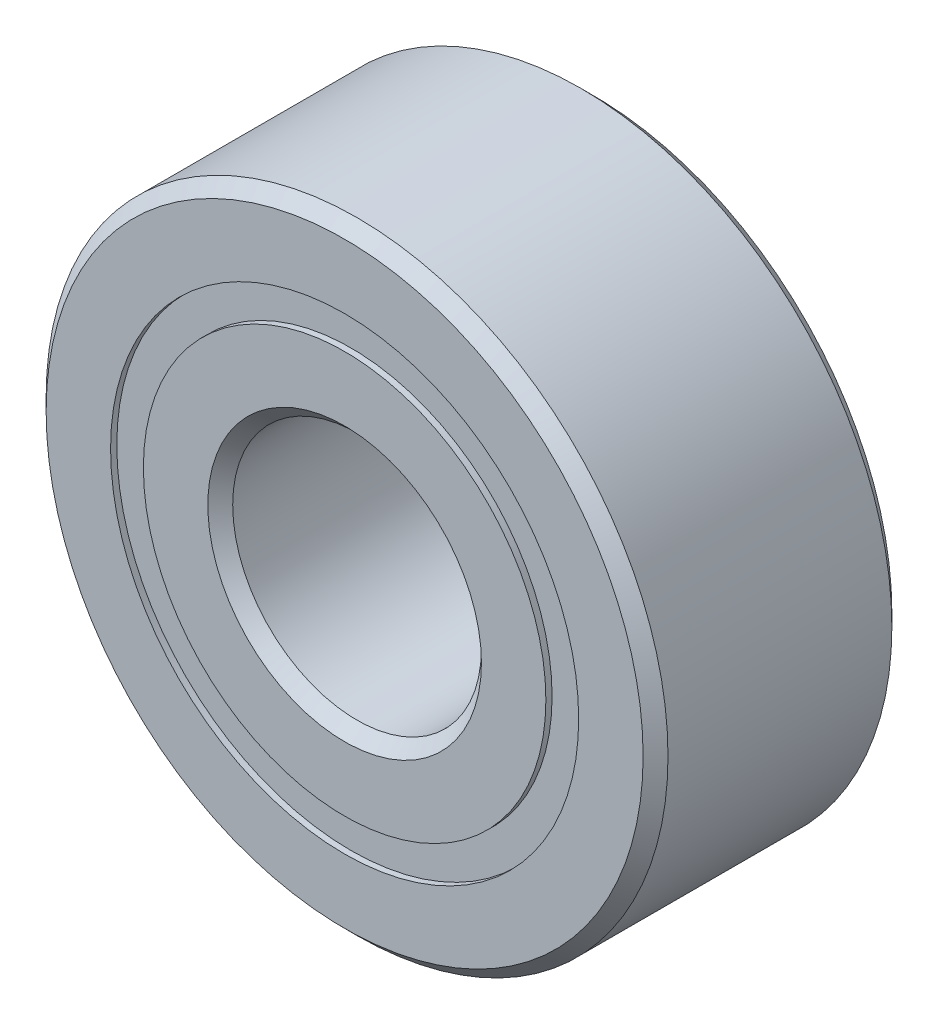
from build123d import *

# Parameters (mm, degrees)
CIRPATTERN1_COUNT = 12
SKETCH5_W         = 0.972810551
SKETCH5_H         = 0.527472528


with BuildPart() as part:
    # Sketch1 → Revolve1 (revolve)
    with BuildSketch(Plane(origin=(0, 0, 0), x_dir=(0, 0, -1), z_dir=(1, 0, 0)), mode=Mode.PRIVATE) as revolve1_sk:
        with BuildLine():
            Line((1.8, 5), (-1.8, 5))
            Line((-1.8, 5), (-2, 4.8))
            Line((-2, 4.8), (-2, 3.763736264))
            Line((-2, 3.763736264), (-0.888888889, 3.763736264))
            ThreePointArc((-0.888888889, 3.763736264), (0, 4.427189449), (0.888888889, 3.763736264))
            Line((0.888888889, 3.763736264), (2, 3.763736264))
            Line((2, 3.763736264), (2, 4.8))
            Line((2, 4.8), (1.8, 5))
        make_face()
    revolve(revolve1_sk.sketch.rotate(Axis((0, 0, 2), (0, 0, -1)), 90), axis=Axis((0, 0, 2), (0, 0, -1)))


with BuildPart() as body_2:
    # Sketch3 → Revolve3 (revolve)
    with BuildSketch(Plane(origin=(0, 0, 0), x_dir=(0, 0, -1), z_dir=(1, 0, 0)), mode=Mode.PRIVATE) as revolve3_sk:
        with BuildLine():
            Line((-2, 3.236263736), (-0.888888889, 3.236263736))
            ThreePointArc((-0.888888889, 3.236263736), (0, 2.572810551), (0.888888889, 3.236263736))
            Line((0.888888889, 3.236263736), (2, 3.236263736))
            Line((2, 3.236263736), (2, 2.2))
            Line((2, 2.2), (1.8, 2))
            Line((1.8, 2), (-1.8, 2))
            Line((-1.8, 2), (-2, 2.2))
            Line((-2, 2.2), (-2, 3.236263736))
        make_face()
    revolve(revolve3_sk.sketch.rotate(Axis((0, 0, 2), (0, 0, -1)), 90), axis=Axis((0, 0, 2), (0, 0, -1)))


with BuildPart() as body_3:
    # Sketch4 → Revolve4 (revolve)
    with BuildSketch(Plane(origin=(0, 0, 0), x_dir=(0, 0, -1), z_dir=(1, 0, 0))):
        with BuildLine():
            Line((-0.927189449, 3.5), (0.927189449, 3.5))
            ThreePointArc((0.927189449, 3.5), (0, 4.427189449), (-0.927189449, 3.5))
        make_face()
    revolve(axis=Axis((0, 3.5, 0.927189449), (0, 0, -1)))


with BuildPart() as cirpattern1_1:
    # CirPattern1: pattern copy
    add(body_3.part.rotate(Axis((0, 0, 0), (0, 0, 1)), 1 * 360 / CIRPATTERN1_COUNT))


with BuildPart() as cirpattern1_2:
    # CirPattern1: pattern copy
    add(body_3.part.rotate(Axis((0, 0, 0), (0, 0, 1)), 2 * 360 / CIRPATTERN1_COUNT))


with BuildPart() as cirpattern1_3:
    # CirPattern1: pattern copy
    add(body_3.part.rotate(Axis((0, 0, 0), (0, 0, 1)), 3 * 360 / CIRPATTERN1_COUNT))


with BuildPart() as cirpattern1_4:
    # CirPattern1: pattern copy
    add(body_3.part.rotate(Axis((0, 0, 0), (0, 0, 1)), 4 * 360 / CIRPATTERN1_COUNT))


with BuildPart() as cirpattern1_5:
    # CirPattern1: pattern copy
    add(body_3.part.rotate(Axis((0, 0, 0), (0, 0, 1)), 5 * 360 / CIRPATTERN1_COUNT))


with BuildPart() as cirpattern1_6:
    # CirPattern1: pattern copy
    add(body_3.part.rotate(Axis((0, 0, 0), (0, 0, 1)), 6 * 360 / CIRPATTERN1_COUNT))


with BuildPart() as cirpattern1_7:
    # CirPattern1: pattern copy
    add(body_3.part.rotate(Axis((0, 0, 0), (0, 0, 1)), 7 * 360 / CIRPATTERN1_COUNT))


with BuildPart() as cirpattern1_8:
    # CirPattern1: pattern copy
    add(body_3.part.rotate(Axis((0, 0, 0), (0, 0, 1)), 8 * 360 / CIRPATTERN1_COUNT))


with BuildPart() as cirpattern1_9:
    # CirPattern1: pattern copy
    add(body_3.part.rotate(Axis((0, 0, 0), (0, 0, 1)), 9 * 360 / CIRPATTERN1_COUNT))


with BuildPart() as cirpattern1_10:
    # CirPattern1: pattern copy
    add(body_3.part.rotate(Axis((0, 0, 0), (0, 0, 1)), 10 * 360 / CIRPATTERN1_COUNT))


with BuildPart() as cirpattern1_11:
    # CirPattern1: pattern copy
    add(body_3.part.rotate(Axis((0, 0, 0), (0, 0, 1)), 11 * 360 / CIRPATTERN1_COUNT))


with BuildPart() as body_15:
    # Sketch5 → Revolve5 (revolve)
    with BuildSketch(Plane(origin=(0, 0, 0), x_dir=(0, 0, -1), z_dir=(1, 0, 0)), mode=Mode.PRIVATE) as revolve5_sk:
        with Locations((-1.413594725, 3.5)):
            Rectangle(SKETCH5_W, SKETCH5_H)
        with Locations((1.413594725, 3.5)):
            Rectangle(SKETCH5_W, SKETCH5_H)
    revolve(revolve5_sk.sketch.rotate(Axis((0, 0, 2), (0, 0, -1)), 90), axis=Axis((0, 0, 2), (0, 0, -1)))


solid = Compound([part.part, body_2.part, body_3.part, cirpattern1_1.part, cirpattern1_2.part, cirpattern1_3.part, cirpattern1_4.part, cirpattern1_5.part, cirpattern1_6.part, cirpattern1_7.part, cirpattern1_8.part, cirpattern1_9.part, cirpattern1_10.part, cirpattern1_11.part, body_15.part])
